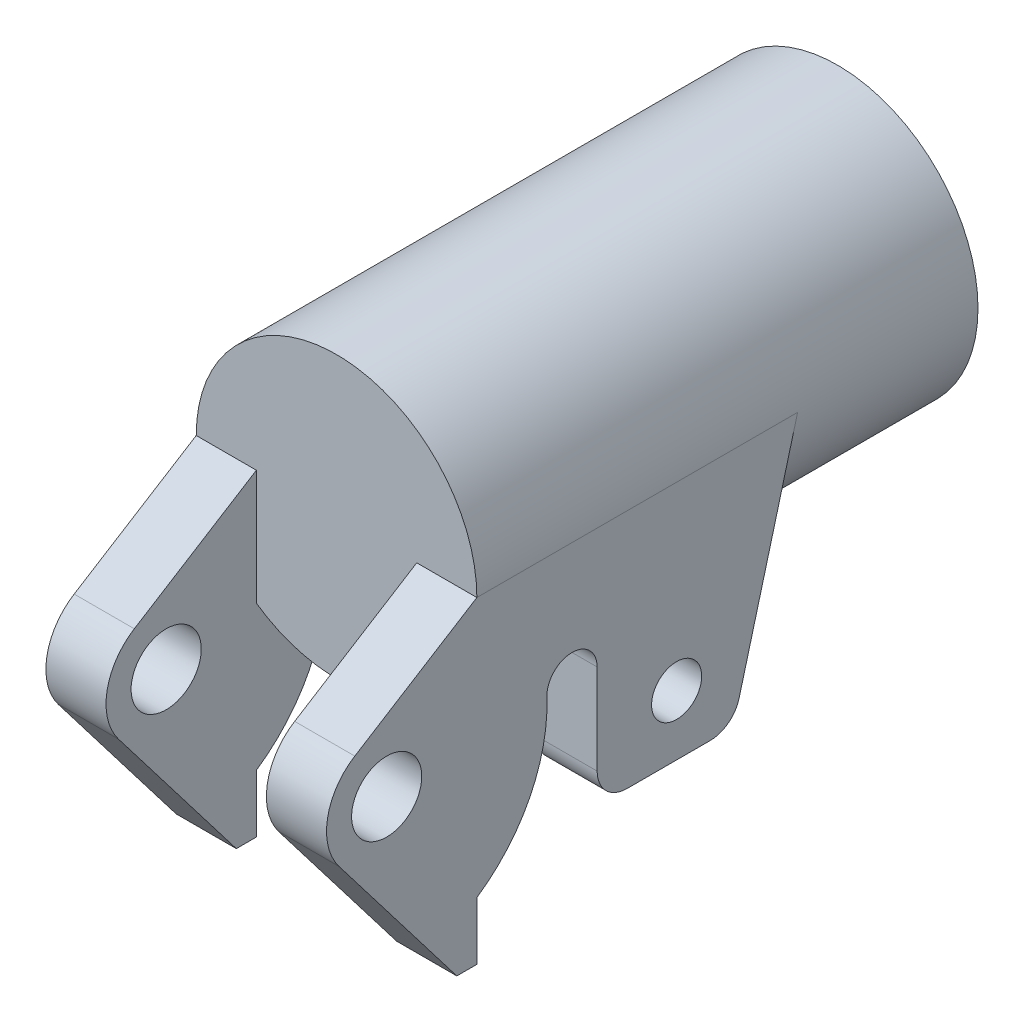
from build123d import *

# Parameters (mm, degrees)
SKETCH1_R               = 14
BOSS_EXTRUDE1_DEPTH     = 50
SKETCH2_R               = 3.5
SKETCH2_R_2             = 2.5
BOSS_EXTRUDE2_DEPTH     = 14
CUT_EXTRUDE3_DEPTH      = 61.834364638
CUT_EXTRUDE3_DEPTH_BACK = 61.834364638
CUT_EXTRUDE4_START      = 57
CUT_EXTRUDE4_DEPTH      = 57
SKETCH6_R               = 11
CUT_EXTRUDE5_DEPTH      = 40


with BuildPart() as part:
    # Sketch1 → Boss-Extrude1 (new body)
    with BuildSketch(Plane.XY):
        Circle(SKETCH1_R)
    extrude(amount=-BOSS_EXTRUDE1_DEPTH)

    # Sketch2 → Boss-Extrude2 (add, symmetric)
    with BuildSketch(Plane(origin=(0, 0, 0), x_dir=(0, 0, -1), z_dir=(1, 0, 0))):
        with BuildLine():
            Line((15, -24), (23.267238418, -24))
            ThreePointArc((23.267238418, -24), (25.093522705, -23.380060021), (26.165015897, -21.776457135))
            Line((26.165015897, -21.776457135), (32, 0))
            Line((32, 0), (0, 0))
            Line((0, 0), (-12.179515585, -7.61060601))
            ThreePointArc((-12.179515585, -7.61060601), (-14.903885139, -11.629249661), (-13.762573354, -16.348263718))
            Line((-13.762573354, -16.348263718), (-2, -31.698894587))
            Line((-2, -31.698894587), (0, -31.698894587))
            Line((0, -31.698894587), (0, -25.927651143))
            ThreePointArc((0, -25.927651143), (5.280940814, -19.913790946), (6.988586602, -12.094660803))
            ThreePointArc((6.988586602, -12.094660803), (9.446060431, -9.493846328), (12, -12))
            Line((12, -12), (12, -21))
            ThreePointArc((12, -21), (12.878679656, -23.121320344), (15, -24))
        make_face()
        with Locations((-9, -12.698894587)):
            Circle(SKETCH2_R, mode=Mode.SUBTRACT)
        with Locations((19.929981273, -18)):
            Circle(SKETCH2_R_2, mode=Mode.SUBTRACT)
    extrude(amount=BOSS_EXTRUDE2_DEPTH, both=True)

    # Sketch4 → Cut-Extrude3 (cut, two sides: drawn at the far end of the back side and taken through both)
    with BuildSketch(Plane.XY.offset(-CUT_EXTRUDE3_DEPTH_BACK)):
        with BuildLine():
            Line((-8, -31.698894587), (-8, -11.489125293))
            ThreePointArc((-8, -11.489125293), (0, -14), (8, -11.489125293))
            Line((8, -11.489125293), (8, -31.698894587))
            Line((8, -31.698894587), (-8, -31.698894587))
        make_face()
    extrude(amount=CUT_EXTRUDE3_DEPTH + CUT_EXTRUDE3_DEPTH_BACK, mode=Mode.SUBTRACT)

    # Sketch5 → Cut-Extrude4 (cut)
    with BuildSketch(Plane.XY.offset(CUT_EXTRUDE4_START)):
        with BuildLine():
            Line((-8, 0), (8, 0))
            Line((8, 0), (8, -11.489125293))
            ThreePointArc((8, -11.489125293), (0, -14), (-8, -11.489125293))
            Line((-8, -11.489125293), (-8, 0))
        make_face()
    extrude(amount=-CUT_EXTRUDE4_DEPTH, mode=Mode.SUBTRACT)

    # Sketch6 → Cut-Extrude5 (cut)
    with BuildSketch(Plane(origin=(0, 0, -50), x_dir=(-1, 0, 0), z_dir=(0, 0, -1))):
        Circle(SKETCH6_R)
    extrude(amount=-CUT_EXTRUDE5_DEPTH, mode=Mode.SUBTRACT)


solid = part.part
